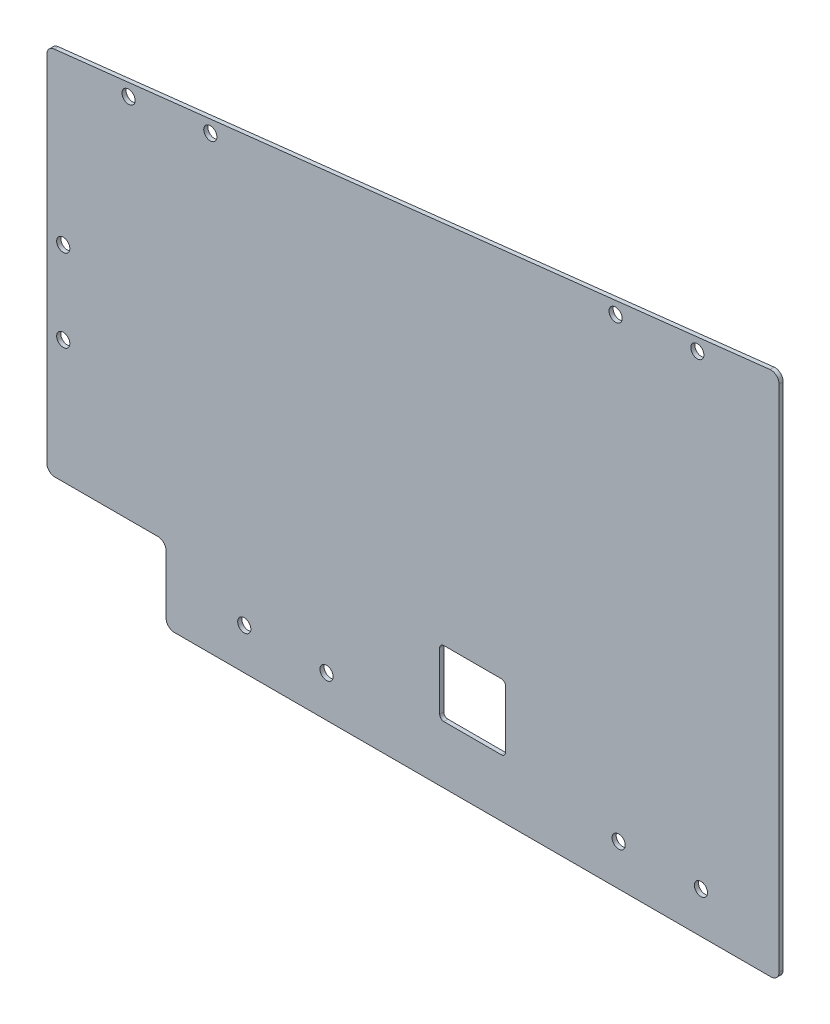
from build123d import *

# Parameters (mm, degrees)
SKETCH_1_W          = 90
SKETCH_1_H          = 14
EXTRUDE_1_DEPTH     = 1
EXTRUDE_2_DEPTH     = 1
SKETCH_4_W          = 40
SKETCH_4_H          = 14
SKETCH_4_W_2        = 19
EXTRUDE_3_DEPTH     = 1
SKETCH_7_R          = 1.6
CUT_EXTRUDE_1_DEPTH = 10
SKETCH_8_R          = 1.6
CUT_EXTRUDE_2_DEPTH = 10
SKETCH_9_R          = 1.6
CUT_EXTRUDE_3_DEPTH = 10
FILLET_1_R          = 2
SKETCH_10_W         = 16
SKETCH_10_H         = 16
CUT_EXTRUDE_4_DEPTH = 10
FILLET_2_R          = 1


with BuildPart() as part:
    # 草图1 → 凸台-拉伸1 (new body)
    with BuildSketch(Plane.XY):
        with Locations((0, -3)):
            Rectangle(SKETCH_1_W, SKETCH_1_H)
    extrude(amount=EXTRUDE_1_DEPTH)

    # 草图2 → 凸台-拉伸2 (add)
    with BuildSketch(Plane.XY.offset(1)):
        Polygon((-85, 8.2), (-85, 4), (64, 4), (64, 118), (-114, 98), (-114, 8.2), align=None)
    extrude(amount=-EXTRUDE_2_DEPTH)

    # 草图4 → 凸台-拉伸3 (add)
    with BuildSketch(Plane.XY.offset(1)):
        with Locations((-65, -3)):
            Rectangle(SKETCH_4_W, SKETCH_4_H)
        with Locations((54.5, -3)):
            Rectangle(SKETCH_4_W_2, SKETCH_4_H)
    extrude(amount=-EXTRUDE_3_DEPTH)

    # 草图7 → 切除-拉伸1 (cut)
    with BuildSketch(Plane.XY.offset(1)):
        with Locations((45, 0)):
            Circle(SKETCH_7_R)
        with Locations((25, 0)):
            Circle(SKETCH_7_R)
        with Locations((-66, 0)):
            Circle(SKETCH_7_R)
        with Locations((-46, 0)):
            Circle(SKETCH_7_R)
    extrude(amount=-CUT_EXTRUDE_1_DEPTH, mode=Mode.SUBTRACT)

    # 草图8 → 切除-拉伸2 (cut)
    with BuildSketch(Plane.XY.offset(1)):
        with Locations((-94.125063758, 97.214261295)):
            Circle(SKETCH_8_R)
        with Locations((-74.250127515, 99.447400198)):
            Circle(SKETCH_8_R)
        with Locations((24.250127515, 110.514844584)):
            Circle(SKETCH_8_R)
        with Locations((44.125063758, 112.747983487)):
            Circle(SKETCH_8_R)
    extrude(amount=-CUT_EXTRUDE_2_DEPTH, mode=Mode.SUBTRACT)

    # 草图9 → 切除-拉伸3 (cut)
    with BuildSketch(Plane(origin=(0, 0, 0), x_dir=(-1, 0, 0), z_dir=(0, 0, -1))):
        with Locations((110, 58.1)):
            Circle(SKETCH_9_R)
        with Locations((110, 38.1)):
            Circle(SKETCH_9_R)
    extrude(amount=-CUT_EXTRUDE_3_DEPTH, mode=Mode.SUBTRACT)

    # 圆角1
    fillet_1_edges = [part.edges().sort_by_distance(p)[0] for p in [
        (-114, 8.2, 0.5),
        (-114, 98, 0.5),
        (64, 118, 0.5),
        (-85, 8.2, 0.5),
        (-85, -10, 0.5),
        (64, -10, 0.5),
    ]]
    fillet(fillet_1_edges, radius=FILLET_1_R)

    # 草图10 → 切除-拉伸4 (cut)
    with BuildSketch(Plane.XY.offset(1)):
        with Locations((-10.5, 12)):
            Rectangle(SKETCH_10_W, SKETCH_10_H)
    extrude(amount=-CUT_EXTRUDE_4_DEPTH, mode=Mode.SUBTRACT)

    # 圆角2
    fillet_2_edges = [part.edges().sort_by_distance(p)[0] for p in [
        (-2.5, 20, 0.5),
        (-2.5, 4, 0.5),
        (-18.5, 4, 0.5),
        (-18.5, 20, 0.5),
    ]]
    fillet(fillet_2_edges, radius=FILLET_2_R)


solid = part.part
